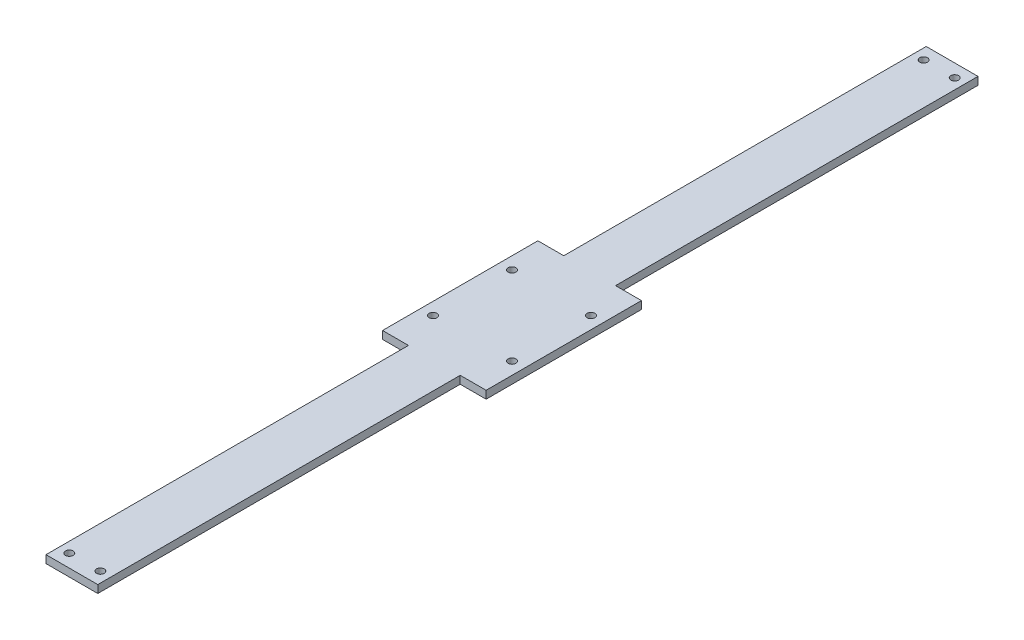
from build123d import *

# Parameters (mm, degrees)
BOSS_EXTRUDE1_DEPTH      = 1.5
F_3_0_3_DIAMETER_HOLE1_D = 3
F_3_0_3_DIAMETER_HOLE2_D = 3


with BuildPart() as part:
    # Sketch1 → Boss-Extrude1 (new, symmetric)
    with BuildSketch(Plane(origin=(0, 0, 0), x_dir=(1, 0, 0), z_dir=(0, 1, 0))):
        Polygon((-10, 170), (-10, 30), (-20, 30), (-20, -30), (-10, -30), (-10, -170), (10, -170), (10, -30), (20, -30), (20, 30), (10, 30), (10, 170), align=None)
    extrude(amount=BOSS_EXTRUDE1_DEPTH, both=True)

    # Ø3.0 (3) Diameter Hole1 (through all)
    with Locations(Plane(origin=(0, 1.5, 0), x_dir=(1, 0, 0), z_dir=(0, 1, 0))):
        with Locations((-15.25, 15.25), (15.25, 15.25), (15.25, -15.25), (-15.25, -15.25)):
            Hole(F_3_0_3_DIAMETER_HOLE1_D / 2)

    # Ø3.0 (3) Diameter Hole2 (through all)
    with Locations(Plane(origin=(0, 1.5, 0), x_dir=(1, 0, 0), z_dir=(0, 1, 0))):
        with Locations((-6, -165), (6, -165), (-6, 165), (6, 165)):
            Hole(F_3_0_3_DIAMETER_HOLE2_D / 2)


solid = part.part
